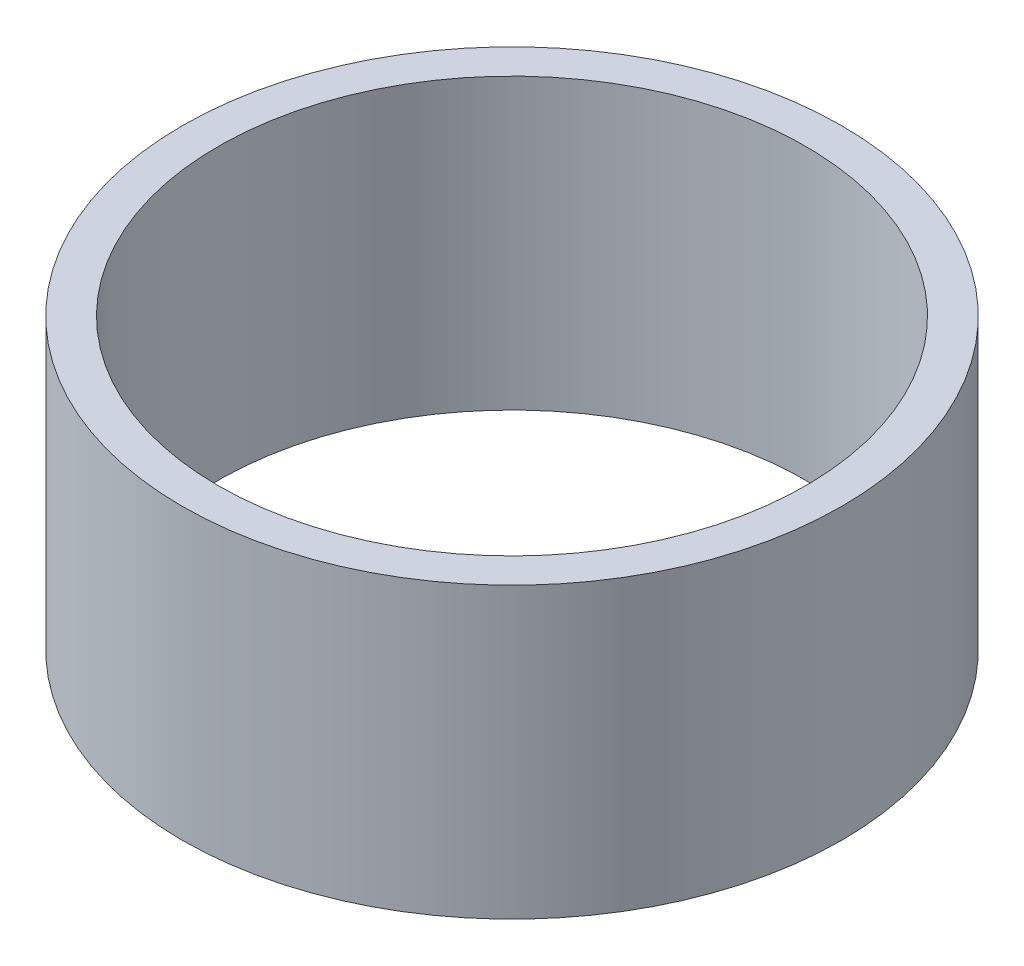
from build123d import *

# Parameters (mm, degrees)
SKETCH1_R           = 14.25
SKETCH1_R_2         = 12.7
BOSS_EXTRUDE1_DEPTH = 12.5


with BuildPart() as part:
    # Sketch1 → Boss-Extrude1 (new body)
    with BuildSketch(Plane(origin=(0, 0, 0), x_dir=(1, 0, 0), z_dir=(0, 1, 0))):
        with Locations(Location((0, 0, 0), (0, 0, 270))):
            Circle(SKETCH1_R)
        with Locations(Location((0, 0, 0), (0, 0, 270))):
            Circle(SKETCH1_R_2, mode=Mode.SUBTRACT)
    extrude(amount=BOSS_EXTRUDE1_DEPTH)


solid = part.part
